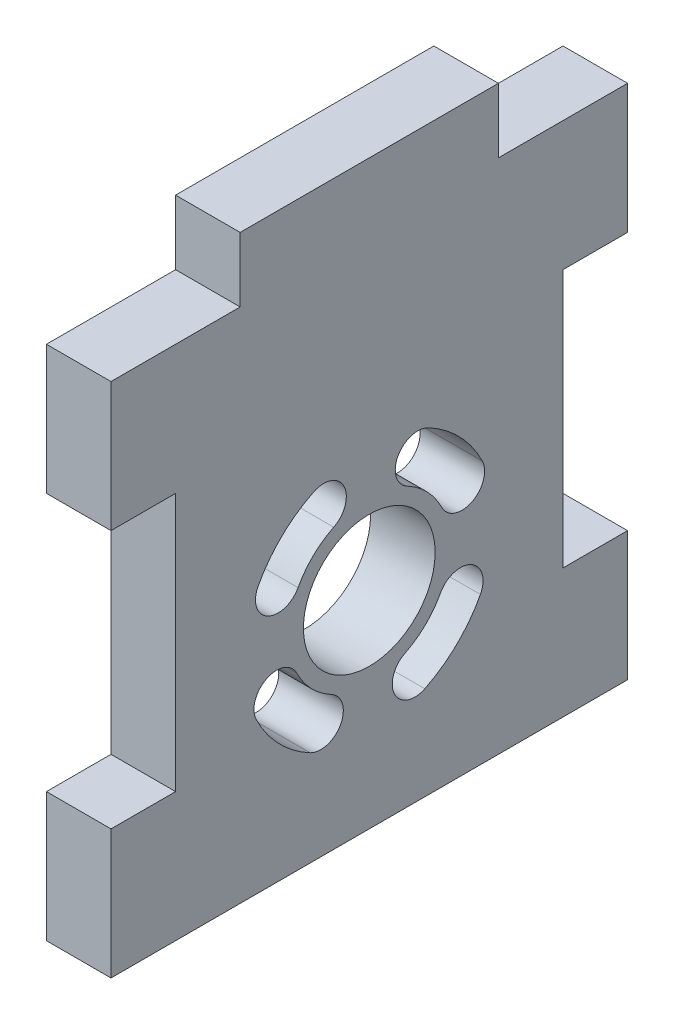
from build123d import *

# Parameters (mm, degrees)
SKETCH_1_R      = 5.1
EXTRUDE_1_DEPTH = 5


with BuildPart() as part:
    # 草图1 → 凸台-拉伸1 (new body)
    with BuildSketch(Plane(origin=(0, 0, 0), x_dir=(0, 0, -1), z_dir=(1, 0, 0))):
        Polygon((-30, 40), (-40, 40), (-40, 30), (-35, 30), (-35, 10), (-40, 10), (-40, 0), (0, 0), (0, 10), (-5, 10), (-5, 30), (0, 30), (0, 40), (-10, 40), (-10, 45), (-30, 45), align=None)
        with Locations((-20, 16)):
            Circle(SKETCH_1_R, mode=Mode.SUBTRACT)
        with BuildLine():
            ThreePointArc((-24.298590679, 24.751263804), (-26.780876657, 23.005869808), (-28.606339093, 20.58185851))
            ThreePointArc((-28.606339093, 20.58185851), (-27.883996425, 18.21474612), (-25.516884034, 18.937088789))
            ThreePointArc((-25.516884034, 18.937088789), (-24.346715806, 20.490942184), (-22.755506846, 21.60978449))
            ThreePointArc((-22.755506846, 21.60978449), (-21.956309105, 23.952066064), (-24.298590679, 24.751263804))
        make_face(mode=Mode.SUBTRACT)
        with BuildLine():
            ThreePointArc((-11.248736196, 20.298590679), (-12.994130192, 22.780876657), (-15.41814149, 24.606339093))
            ThreePointArc((-15.41814149, 24.606339093), (-17.78525388, 23.883996425), (-17.062911211, 21.516884034))
            ThreePointArc((-17.062911211, 21.516884034), (-15.509057816, 20.346715806), (-14.39021551, 18.755506846))
            ThreePointArc((-14.39021551, 18.755506846), (-12.047933936, 17.956309105), (-11.248736196, 20.298590679))
        make_face(mode=Mode.SUBTRACT)
        with BuildLine():
            ThreePointArc((-15.701409321, 7.248736196), (-13.219123343, 8.994130192), (-11.393660907, 11.41814149))
            ThreePointArc((-11.393660907, 11.41814149), (-12.116003575, 13.78525388), (-14.483115966, 13.062911211))
            ThreePointArc((-14.483115966, 13.062911211), (-15.653284194, 11.509057816), (-17.244493154, 10.39021551))
            ThreePointArc((-17.244493154, 10.39021551), (-18.043690895, 8.047933936), (-15.701409321, 7.248736196))
        make_face(mode=Mode.SUBTRACT)
        with BuildLine():
            ThreePointArc((-28.751263804, 11.701409321), (-27.005869808, 9.219123343), (-24.58185851, 7.393660907))
            ThreePointArc((-24.58185851, 7.393660907), (-22.21474612, 8.116003575), (-22.937088789, 10.483115966))
            ThreePointArc((-22.937088789, 10.483115966), (-24.490942184, 11.653284194), (-25.60978449, 13.244493154))
            ThreePointArc((-25.60978449, 13.244493154), (-27.952066064, 14.043690895), (-28.751263804, 11.701409321))
        make_face(mode=Mode.SUBTRACT)
    extrude(amount=EXTRUDE_1_DEPTH)


solid = part.part
